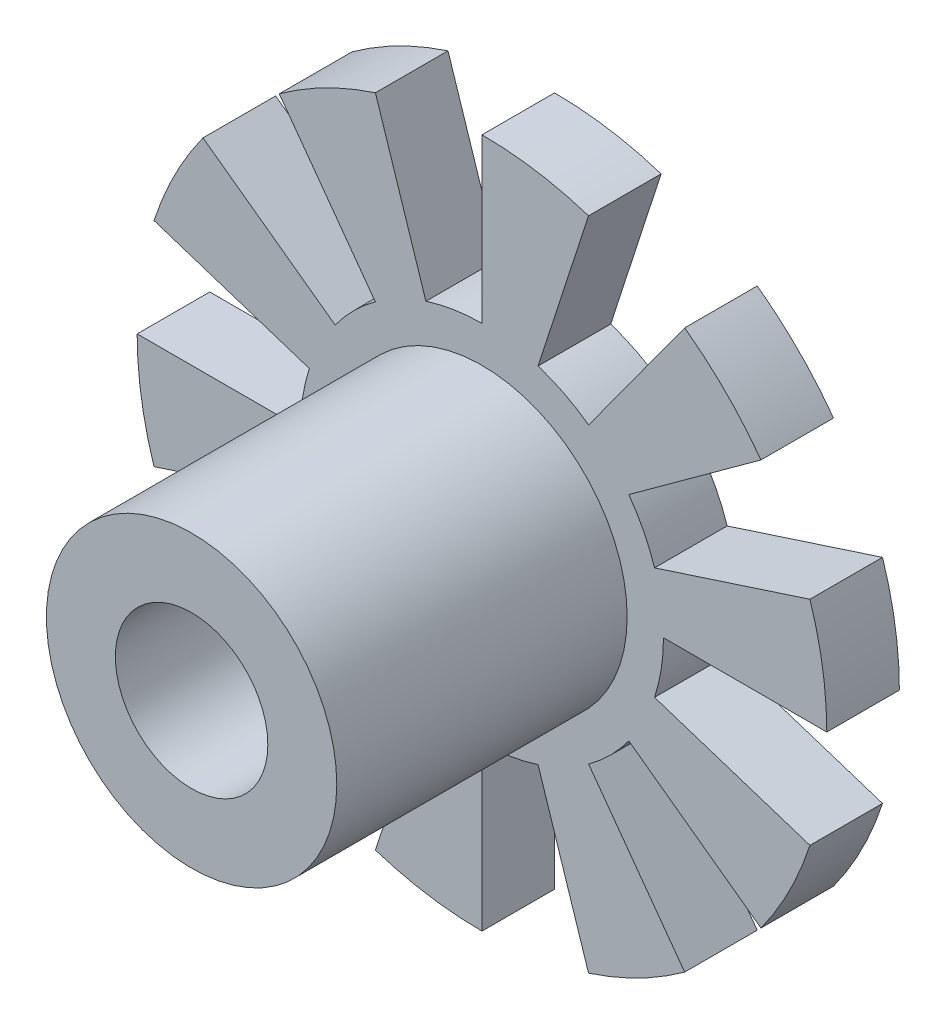
from build123d import *

# Parameters (mm, degrees)
ESQUISSE1_R        = 2.1
BOSS_EXTRU_3_DEPTH = 2
ESQUISSE1_3_R      = 4
ESQUISSE1_3_R_2    = 2.1
BOSS_EXTRU_4_DEPTH = 10


with BuildPart() as part:
    # Esquisse1 → Boss.-Extru.3 (new body)
    with BuildSketch(Plane.XY):
        with BuildLine():
            Line((0, 9.5), (0, 5))
            ThreePointArc((0, 5), (-0.782172325, 4.938441703), (-1.545084972, 4.755282581))
            Line((-1.545084972, 4.755282581), (-2.935661447, 9.035036905))
            ThreePointArc((-2.935661447, 9.035036905), (-4.312909748, 8.46456198), (-5.583959897, 7.685661447))
            Line((-5.583959897, 7.685661447), (-2.938926261, 4.045084972))
            ThreePointArc((-2.938926261, 4.045084972), (-3.535533906, 3.535533906), (-4.045084972, 2.938926261))
            Line((-4.045084972, 2.938926261), (-7.685661447, 5.583959897))
            ThreePointArc((-7.685661447, 5.583959897), (-8.46456198, 4.312909748), (-9.035036905, 2.935661447))
            Line((-9.035036905, 2.935661447), (-4.755282581, 1.545084972))
            ThreePointArc((-4.755282581, 1.545084972), (-4.938441703, 0.782172325), (-5, 0))
            Line((-5, 0), (-9.5, 0))
            ThreePointArc((-9.5, 0), (-9.383039236, -1.486127418), (-9.035036905, -2.935661447))
            Line((-9.035036905, -2.935661447), (-4.755282581, -1.545084972))
            ThreePointArc((-4.755282581, -1.545084972), (-4.455032621, -2.269952499), (-4.045084972, -2.938926261))
            Line((-4.045084972, -2.938926261), (-7.685661447, -5.583959897))
            ThreePointArc((-7.685661447, -5.583959897), (-6.717514421, -6.717514421), (-5.583959897, -7.685661447))
            Line((-5.583959897, -7.685661447), (-2.938926261, -4.045084972))
            ThreePointArc((-2.938926261, -4.045084972), (-2.269952499, -4.455032621), (-1.545084972, -4.755282581))
            Line((-1.545084972, -4.755282581), (-2.935661447, -9.035036905))
            ThreePointArc((-2.935661447, -9.035036905), (-1.486127418, -9.383039236), (0, -9.5))
            Line((0, -9.5), (0, -5))
            ThreePointArc((0, -5), (0.782172325, -4.938441703), (1.545084972, -4.755282581))
            Line((1.545084972, -4.755282581), (2.935661447, -9.035036905))
            ThreePointArc((2.935661447, -9.035036905), (4.312909748, -8.46456198), (5.583959897, -7.685661447))
            Line((5.583959897, -7.685661447), (2.938926261, -4.045084972))
            ThreePointArc((2.938926261, -4.045084972), (3.535533906, -3.535533906), (4.045084972, -2.938926261))
            Line((4.045084972, -2.938926261), (7.685661447, -5.583959897))
            ThreePointArc((7.685661447, -5.583959897), (8.46456198, -4.312909748), (9.035036905, -2.935661447))
            Line((9.035036905, -2.935661447), (4.755282581, -1.545084972))
            ThreePointArc((4.755282581, -1.545084972), (4.938441703, -0.782172325), (5, 0))
            Line((5, 0), (9.5, 0))
            ThreePointArc((9.5, 0), (9.383039236, 1.486127418), (9.035036905, 2.935661447))
            Line((9.035036905, 2.935661447), (4.755282581, 1.545084972))
            ThreePointArc((4.755282581, 1.545084972), (4.455032621, 2.269952499), (4.045084972, 2.938926261))
            Line((4.045084972, 2.938926261), (7.685661447, 5.583959897))
            ThreePointArc((7.685661447, 5.583959897), (6.717514421, 6.717514421), (5.583959897, 7.685661447))
            Line((5.583959897, 7.685661447), (2.938926261, 4.045084972))
            ThreePointArc((2.938926261, 4.045084972), (2.269952499, 4.455032621), (1.545084972, 4.755282581))
            Line((1.545084972, 4.755282581), (2.935661447, 9.035036905))
            ThreePointArc((2.935661447, 9.035036905), (1.486127418, 9.383039236), (0, 9.5))
        make_face()
        Circle(ESQUISSE1_R, mode=Mode.SUBTRACT)
    extrude(amount=BOSS_EXTRU_3_DEPTH)

    # Esquisse1<3> → Boss.-Extru.4 (add)
    with BuildSketch(Plane.XY):
        Circle(ESQUISSE1_3_R)
        Circle(ESQUISSE1_3_R_2, mode=Mode.SUBTRACT)
    extrude(amount=BOSS_EXTRU_4_DEPTH)


solid = part.part
